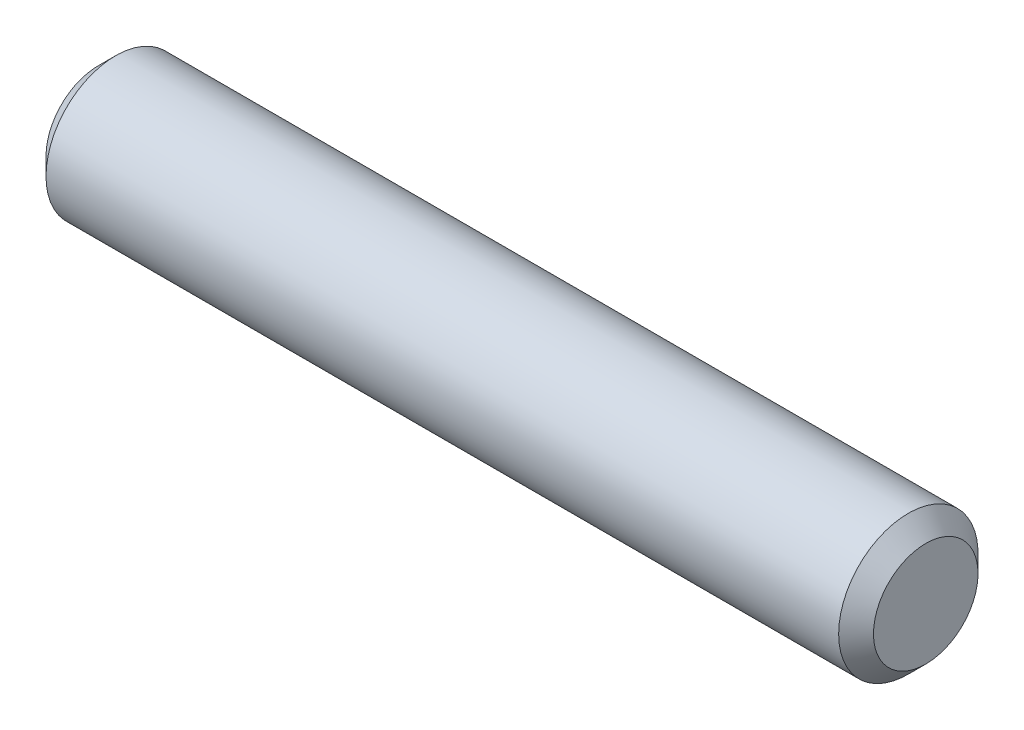
from build123d import *


with BuildPart() as part:
    # Sketch1 → Revolve1 (revolve)
    with BuildSketch(Plane.XY, mode=Mode.PRIVATE) as revolve1_sk:
        Polygon((-23.75, 0), (-23.75, 3), (-22.75, 4), (22.75, 4), (23.75, 3), (23.75, 0), align=None)
    revolve(revolve1_sk.sketch.rotate(Axis((-23.75, 0, 0), (1, 0, 0)), 90), axis=Axis((-23.75, 0, 0), (1, 0, 0)))


solid = part.part
